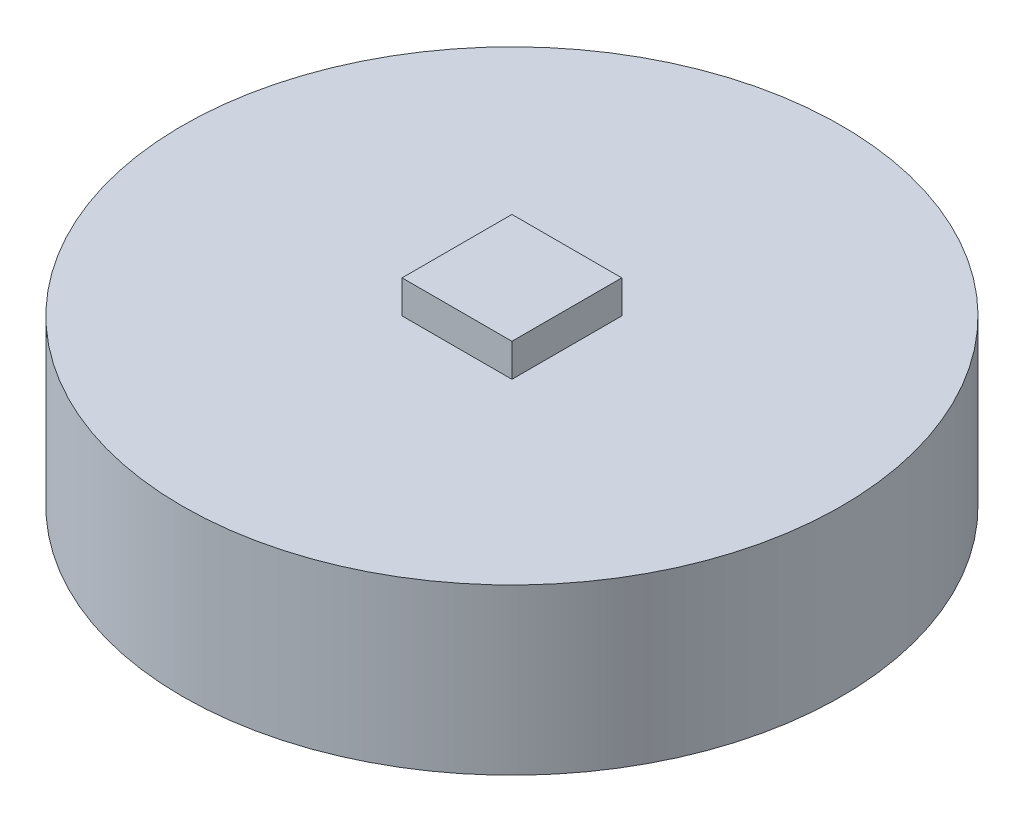
from build123d import *

# Parameters (mm, degrees)
SKETCH1_R           = 30
BOSS_EXTRUDE1_DEPTH = 15
SKETCH2_W           = 10
SKETCH2_H           = 10
BOSS_EXTRUDE2_DEPTH = 3
SKETCH3_W           = 10
SKETCH3_H           = 10
CUT_EXTRUDE1_DEPTH  = 3


with BuildPart() as part:
    # Sketch1 → Boss-Extrude1 (new body)
    with BuildSketch(Plane(origin=(0, 0, 0), x_dir=(1, 0, 0), z_dir=(0, 1, 0))):
        with Locations(Location((0, 0, 0), (0, 0, 270))):
            Circle(SKETCH1_R)
    extrude(amount=BOSS_EXTRUDE1_DEPTH)

    # Sketch2 → Boss-Extrude2 (add)
    with BuildSketch(Plane(origin=(0, 15, 0), x_dir=(1, 0, 0), z_dir=(0, 1, 0))):
        Rectangle(SKETCH2_W, SKETCH2_H)
    extrude(amount=BOSS_EXTRUDE2_DEPTH)

    # Sketch3 → Cut-Extrude1 (cut)
    with BuildSketch(Plane.XZ):
        Rectangle(SKETCH3_W, SKETCH3_H)
    extrude(amount=-CUT_EXTRUDE1_DEPTH, mode=Mode.SUBTRACT)


solid = part.part
